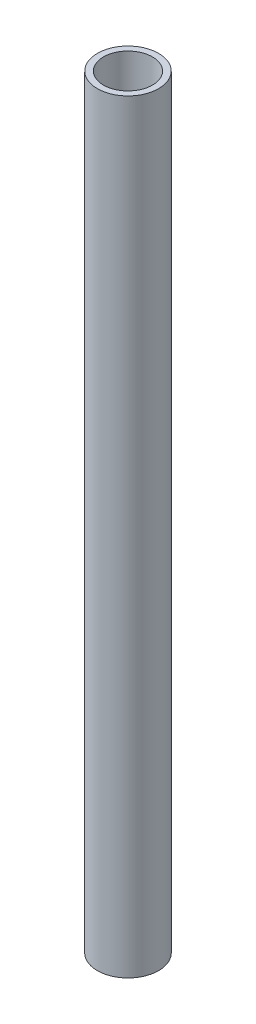
from build123d import *

# Parameters (mm, degrees)
SKETCH1_R           = 1.25
SKETCH1_R_2         = 1
BOSS_EXTRUDE1_DEPTH = 31.2


with BuildPart() as part:
    # Sketch1 → Boss-Extrude1 (new body)
    with BuildSketch(Plane(origin=(0, 0, 0), x_dir=(1, 0, 0), z_dir=(0, 1, 0))):
        with Locations(Location((0, 0, 0), (0, 0, 270))):
            Circle(SKETCH1_R)
        with Locations(Location((0, 0, 0), (0, 0, 270))):
            Circle(SKETCH1_R_2, mode=Mode.SUBTRACT)
    extrude(amount=BOSS_EXTRUDE1_DEPTH)


solid = part.part
